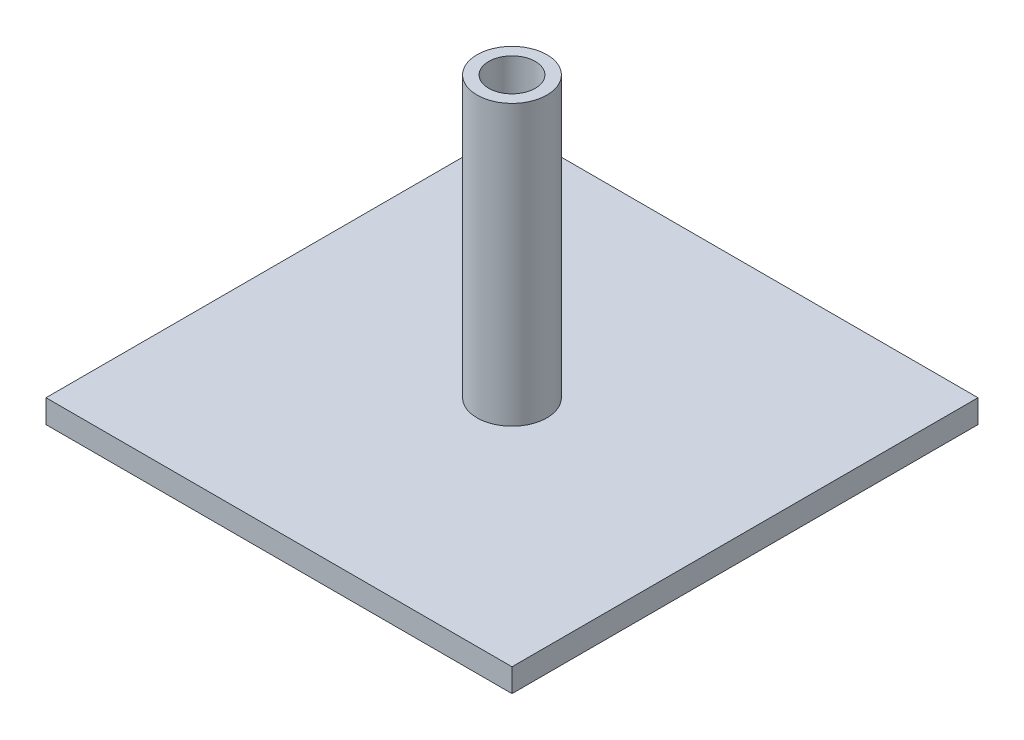
from build123d import *

# Parameters (mm, degrees)
ESBO_O1_W                = 100
ESBO_O1_H                = 100
RESSALTO_EXTRUS_O1_DEPTH = 5
ESBO_O2_R                = 7.5
ESBO_O2_R_2              = 5
RESSALTO_EXTRUS_O2_DEPTH = 60


with BuildPart() as part:
    # Esboço1 → Ressalto-extrusão1 (new body)
    with BuildSketch(Plane(origin=(0, 0, 0), x_dir=(1, 0, 0), z_dir=(0, 1, 0))):
        Rectangle(ESBO_O1_W, ESBO_O1_H)
    extrude(amount=-RESSALTO_EXTRUS_O1_DEPTH)

    # Esboço2 → Ressalto-extrusão2 (add)
    with BuildSketch(Plane(origin=(0, 0, 0), x_dir=(1, 0, 0), z_dir=(0, 1, 0))):
        with Locations(Location((0, 0, 0), (0, 0, 270))):
            Circle(ESBO_O2_R)
        with Locations(Location((0, 0, 0), (0, 0, 270))):
            Circle(ESBO_O2_R_2, mode=Mode.SUBTRACT)
    extrude(amount=RESSALTO_EXTRUS_O2_DEPTH)


solid = part.part
